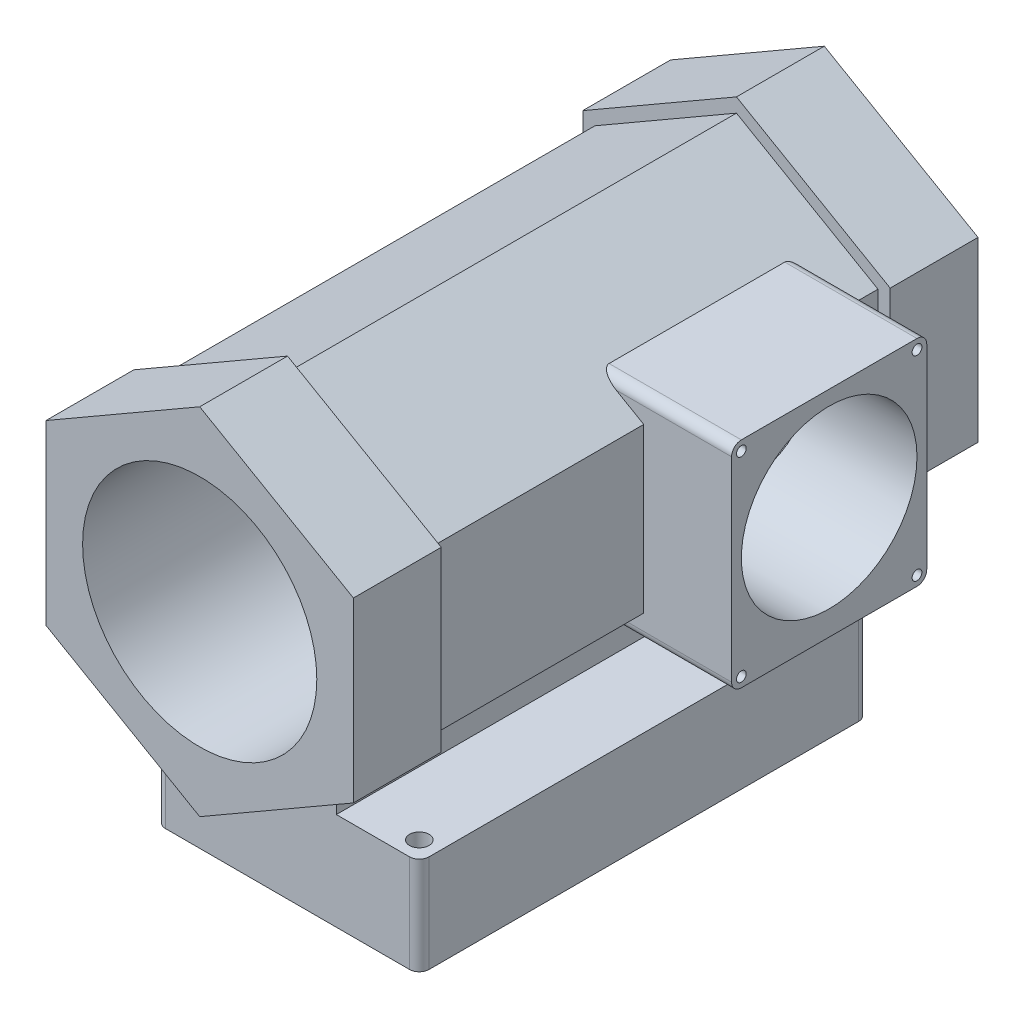
from build123d import *

# Parameters (mm, degrees)
EXTRUDE_1_DEPTH          = 230
EXTRUDE_2_DEPTH          = 90
EXTRUDE_3_DEPTH          = 90
EXTRUDE_3_DEPTH_BACK     = 145
SKETCH_5_W               = 200
SKETCH_5_H               = 220
SKETCH_4_R               = 120
CUT_EXTRUDE_1_DEPTH      = 745.865759718
CUT_EXTRUDE_2_REACH      = 590.605
CUT_EXTRUDE_2_END_RADIUS = 120
SKETCH_6_R               = 90
CUT_EXTRUDE_3_REACH      = 626.355
SKETCH_7_R               = 10
SKETCH_8_R               = 5
CUT_EXTRUDE_4_DEPTH      = 30
FILLET_1_R               = 10
FILLET_2_R               = 10


with BuildPart() as part:
    # Эскиз1 → Бобышка-Вытянуть1 (new body)
    with BuildSketch(Plane.XY):
        Polygon((-50, -200), (-50, -138.564064606), (-145, -83.715789032), (-145, 83.715789032), (0, 167.431578065), (145, 83.715789032), (145, -83.715789032), (50, -138.564064606), (50, -200), (135, -200), (135, -300), (-135, -300), (-135, -200), align=None)
    extrude(amount=EXTRUDE_1_DEPTH)

    # Эскиз2 → Бобышка-Вытянуть2 (add)
    with BuildSketch(Plane.XY.offset(230)):
        Polygon((0, 181.865334795), (-157.5, 90.932667397), (-157.5, -90.932667397), (0, -181.865334795), (157.5, -90.932667397), (157.5, 90.932667397), align=None)
    extrude(amount=EXTRUDE_2_DEPTH)

    # Зеркальное отражение1: part across plane


with BuildPart() as part_1:
    add(part.part)
    add(part.part.mirror(Plane.XY))

    # Эскиз5 → Бобышка-Вытянуть3 (add, two sides: drawn at the far end of the back side and taken through both)
    with BuildSketch(Plane(origin=(145, 0, 0), x_dir=(0, 0, -1), z_dir=(1, 0, 0)).offset(-EXTRUDE_3_DEPTH_BACK)):
        with Locations((90, 0)):
            Rectangle(SKETCH_5_W, SKETCH_5_H)
    extrude(amount=EXTRUDE_3_DEPTH + EXTRUDE_3_DEPTH_BACK)

    # Эскиз4 → Вырез-Вытянуть1 (cut, through all)
    with BuildSketch(Plane.XY.offset(320)):
        Circle(SKETCH_4_R)
    extrude(amount=-CUT_EXTRUDE_1_DEPTH, mode=Mode.SUBTRACT)

    # Вырез-Вытянуть2: up to this cylinder (the profile starts outside it)
    cut_extrude_2_end = Plane(origin=(0, 0, -90), z_dir=(0, 0, 1)) * Cylinder(CUT_EXTRUDE_2_END_RADIUS, 1422.21, mode=Mode.PRIVATE)
    # Эскиз6 → Вырез-Вытянуть2 (cut, up to the surface)
    with BuildSketch(Plane(origin=(235, 0, 0), x_dir=(0, 0, -1), z_dir=(1, 0, 0)), mode=Mode.PRIVATE) as cut_extrude_2_sk1:
        with Locations((90, 5)):
            Circle(SKETCH_6_R)
    cut_extrude_2_tool1 = extrude(cut_extrude_2_sk1.sketch, amount=-CUT_EXTRUDE_2_REACH, mode=Mode.PRIVATE) - cut_extrude_2_end
    add(cut_extrude_2_tool1.solids().sort_by_distance((235, 5, -90))[0], mode=Mode.SUBTRACT)

    # Эскиз7 → Вырез-Вытянуть3 (cut, up to next)
    with BuildSketch(Plane.XZ.offset(300), mode=Mode.PRIVATE) as cut_extrude_3_sk1:
        with Locations(Location((115, 210, 0), (0, 0, 270))):
            Circle(SKETCH_7_R)
    cut_extrude_3_tool1 = extrude(cut_extrude_3_sk1.sketch, amount=-CUT_EXTRUDE_3_REACH, mode=Mode.PRIVATE) & part_1.part
    # Эскиз7 → Вырез-Вытянуть3 (cut, up to next)
    with BuildSketch(Plane.XZ.offset(300), mode=Mode.PRIVATE) as cut_extrude_3_sk2:
        with Locations(Location((-115, 210, 0), (0, 0, 270))):
            Circle(SKETCH_7_R)
    cut_extrude_3_tool2 = extrude(cut_extrude_3_sk2.sketch, amount=-CUT_EXTRUDE_3_REACH, mode=Mode.PRIVATE) & part_1.part
    # Эскиз7 → Вырез-Вытянуть3 (cut, up to next)
    with BuildSketch(Plane.XZ.offset(300), mode=Mode.PRIVATE) as cut_extrude_3_sk3:
        with Locations(Location((115, -210, 0), (0, 0, 270))):
            Circle(SKETCH_7_R)
    cut_extrude_3_tool3 = extrude(cut_extrude_3_sk3.sketch, amount=-CUT_EXTRUDE_3_REACH, mode=Mode.PRIVATE) & part_1.part
    # Эскиз7 → Вырез-Вытянуть3 (cut, up to next)
    with BuildSketch(Plane.XZ.offset(300), mode=Mode.PRIVATE) as cut_extrude_3_sk4:
        with Locations(Location((-115, -210, 0), (0, 0, 270))):
            Circle(SKETCH_7_R)
    cut_extrude_3_tool4 = extrude(cut_extrude_3_sk4.sketch, amount=-CUT_EXTRUDE_3_REACH, mode=Mode.PRIVATE) & part_1.part
    add(cut_extrude_3_tool1.solids().sort_by_distance((115, -300, 210))[0], mode=Mode.SUBTRACT)
    add(cut_extrude_3_tool2.solids().sort_by_distance((-115, -300, 210))[0], mode=Mode.SUBTRACT)
    add(cut_extrude_3_tool3.solids().sort_by_distance((115, -300, -210))[0], mode=Mode.SUBTRACT)
    add(cut_extrude_3_tool4.solids().sort_by_distance((-115, -300, -210))[0], mode=Mode.SUBTRACT)

    # Эскиз8 → Вырез-Вытянуть4 (cut)
    with BuildSketch(Plane(origin=(235, 0, 0), x_dir=(0, 0, -1), z_dir=(1, 0, 0))):
        with Locations((0, 100)):
            Circle(SKETCH_8_R)
        with Locations((0, -100)):
            Circle(SKETCH_8_R)
        with Locations((180, 100)):
            Circle(SKETCH_8_R)
        with Locations((180, -100)):
            Circle(SKETCH_8_R)
    extrude(amount=-CUT_EXTRUDE_4_DEPTH, mode=Mode.SUBTRACT)

    # Скругление1
    fillet_1_edges = [part_1.edges().sort_by_distance(p)[0] for p in [
        (-135, -250, 230),
        (135, -250, 230),
        (-135, -250, -230),
        (135, -250, -230),
    ]]
    fillet(fillet_1_edges, radius=FILLET_1_R)

    # Скругление2
    fillet_2_edges = [part_1.edges().sort_by_distance(p)[0] for p in [
        (167.237205584, 110, 10),
        (167.237205584, -110, -190),
        (167.237205584, 110, -190),
        (167.237205584, -110, 10),
    ]]
    fillet(fillet_2_edges, radius=FILLET_2_R)


solid = part_1.part
